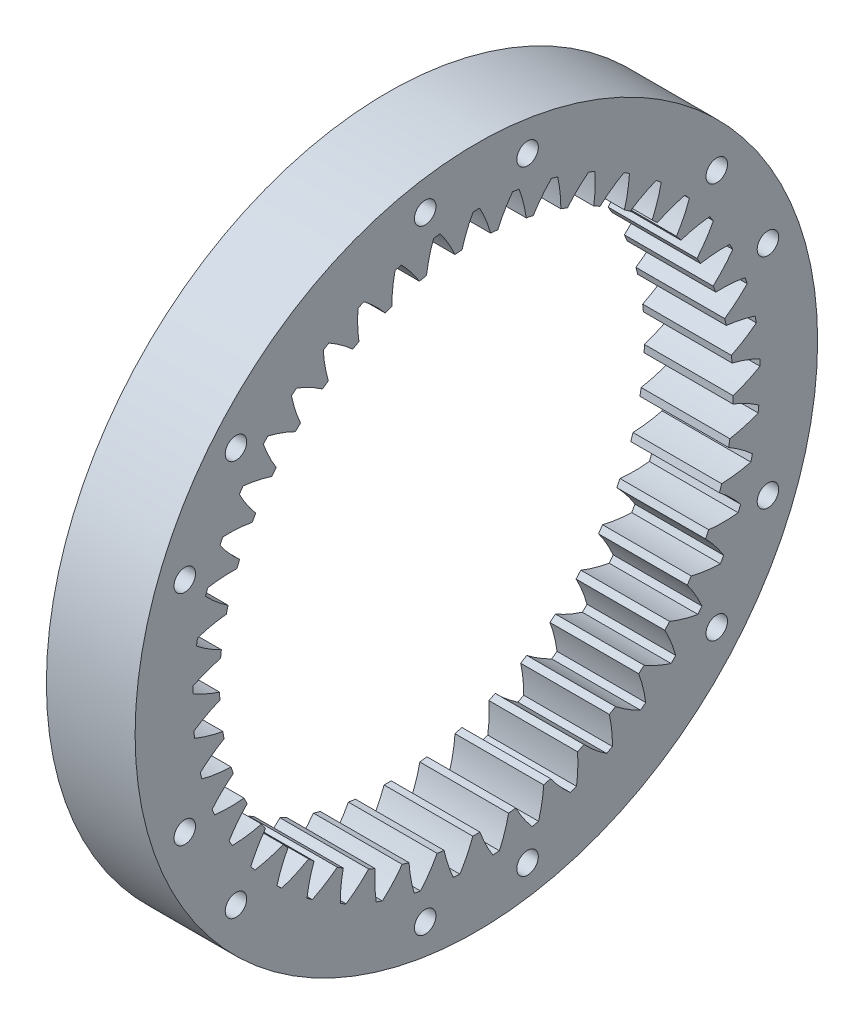
from build123d import *

# Parameters (mm, degrees)
BASPROSKE_W         = 13
BASPROSKE_H         = 3.9639
TOOTHCUT_DEPTH      = 61.23514926
TEETHCUTS_COUNT     = 45
TEETHCUTS_ANGLE     = 352
SKETCH1_R           = 50
SKETCH1_R_2         = 41.5889
BOSS_EXTRUDE1_DEPTH = 13
CUT_EXTRUDE1_REACH  = 73.896
SKETCH3_R           = 1.575
CIRPATTERN1_COUNT   = 6


with BuildPart() as part:
    # BasProSke → Base-Revolve (revolve)
    with BuildSketch(Plane(origin=(0, 0, 0), x_dir=(1, 0, 0), z_dir=(0, 1, 0)), mode=Mode.PRIVATE) as base_revolve_sk:
        with Locations((6.5, 39.60695)):
            Rectangle(BASPROSKE_W, BASPROSKE_H)
    revolve(base_revolve_sk.sketch.rotate(Axis((-10, 0, 0), (1, 0, 0)), 180), axis=Axis((-10, 0, 0), (1, 0, 0)))

    # TooCutSke → ToothCut (cut, through all)
    with BuildSketch(Plane(origin=(0, 0, 0), x_dir=(0, 0, -1), z_dir=(1, 0, 0))):
        with BuildLine():
            ThreePointArc((2.110844515, 37.540301752), (1.407646344, 39.595489653), (0.48232054, 41.560701379))
            ThreePointArc((0.48232054, 41.560701379), (0, 41.5635), (-0.48232054, 41.560701379))
            ThreePointArc((-0.48232054, 41.560701379), (-1.407646344, 39.595489653), (-2.110844515, 37.540301752))
            ThreePointArc((-2.110844515, 37.540301752), (0, 37.5996), (2.110844515, 37.540301752))
        make_face()
    toothcut = extrude(amount=TOOTHCUT_DEPTH, mode=Mode.SUBTRACT)

    # TeethCuts: ToothCut ×45 about axis
    teethcuts_axis = Axis((-10, 0, 0), (1, 0, 0))
    for i in range(1, TEETHCUTS_COUNT):
        add(toothcut.rotate(teethcuts_axis, i * TEETHCUTS_ANGLE / (TEETHCUTS_COUNT - 1)), mode=Mode.SUBTRACT)

    # Sketch1 → Boss-Extrude1 (add)
    with BuildSketch(Plane(origin=(13, 0, 0), x_dir=(0, 0, -1), z_dir=(1, 0, 0))):
        Circle(SKETCH1_R)
        Circle(SKETCH1_R_2, mode=Mode.SUBTRACT)
    extrude(amount=-BOSS_EXTRUDE1_DEPTH)

    # Sketch3 → Cut-Extrude1 (cut, up to next)
    with BuildSketch(Plane.ZY, mode=Mode.PRIVATE) as cut_extrude1_sk1:
        with Locations((-7.5, -45)):
            Circle(SKETCH3_R)
    cut_extrude1_tool1 = extrude(cut_extrude1_sk1.sketch, amount=-CUT_EXTRUDE1_REACH, mode=Mode.PRIVATE) & part.part
    # Sketch3 → Cut-Extrude1 (cut, up to next)
    with BuildSketch(Plane.ZY, mode=Mode.PRIVATE) as cut_extrude1_sk2:
        with Locations((7.5, -45)):
            Circle(SKETCH3_R)
    cut_extrude1_tool2 = extrude(cut_extrude1_sk2.sketch, amount=-CUT_EXTRUDE1_REACH, mode=Mode.PRIVATE) & part.part
    cut_extrude1_1 = cut_extrude1_tool1.solids().sort_by_distance((0, -45, -7.5))[0]
    add(cut_extrude1_1, mode=Mode.SUBTRACT)
    cut_extrude1_2 = cut_extrude1_tool2.solids().sort_by_distance((0, -45, 7.5))[0]
    add(cut_extrude1_2, mode=Mode.SUBTRACT)
    cut_extrude1 = cut_extrude1_1 + cut_extrude1_2  # Cut-Extrude1 as one shape, for the pattern or mirror that repeats it

    # CirPattern1: Cut-Extrude1 ×6 about axis
    cirpattern1_axis = Axis((0, 0, 0), (1, 0, 0))
    for i in range(1, CIRPATTERN1_COUNT):
        add(cut_extrude1.rotate(cirpattern1_axis, i * 360 / CIRPATTERN1_COUNT), mode=Mode.SUBTRACT)


solid = part.part
